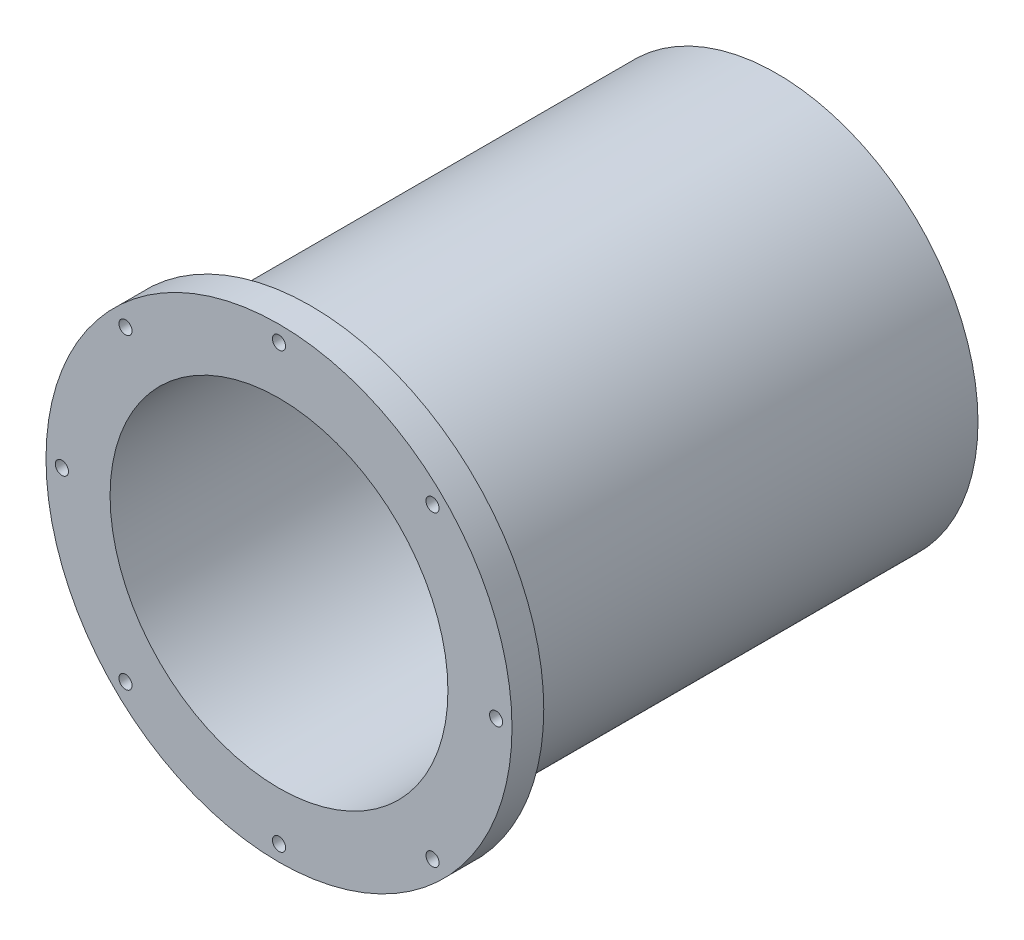
from build123d import *

# Parameters (mm, degrees)
IZIM1_R                     = 55
Y_KSEKLIK_EKSTR_ZYON1_DEPTH = 11
IZIM2_OUTSIDE_W             = 143.422
IZIM2_OUTSIDE_H             = 143.422
IZIM2_OUTSIDE_R             = 47.5
KES_EKSTR_ZYON1_DEPTH       = 14.5
IZIM3_R                     = 1.55
KES_EKSTR_ZYON2_DEPTH       = 80.121741639
DAIRESEL_KAPLAMA1_COUNT     = 8
IZIM4_R                     = 39.875
KES_EKSTR_ZYON3_DEPTH       = 81.833161512
IZIM5_R                     = 47.5
IZIM5_R_2                   = 39.875
Y_KSEKLIK_EKSTR_ZYON2_DEPTH = 95.5


with BuildPart() as part:
    # Çizim1 → Yükseklik-Ekstrüzyon1 (new, symmetric)
    with BuildSketch(Plane.XY):
        Circle(IZIM1_R)
    extrude(amount=Y_KSEKLIK_EKSTR_ZYON1_DEPTH, both=True)

    # Çizim2 outside → Kes-Ekstrüzyon1 (cut)
    with BuildSketch(Plane(origin=(0, 0, -11), x_dir=(-1, 0, 0), z_dir=(0, 0, -1))):
        Rectangle(IZIM2_OUTSIDE_W, IZIM2_OUTSIDE_H)
        Circle(IZIM2_OUTSIDE_R, mode=Mode.SUBTRACT)
    extrude(amount=-KES_EKSTR_ZYON1_DEPTH, mode=Mode.SUBTRACT)

    # Çizim3 → Kes-Ekstrüzyon2 (cut, through all)
    with BuildSketch(Plane(origin=(0, 0, 3.5), x_dir=(-1, 0, 0), z_dir=(0, 0, -1))):
        with Locations((0, 51.25)):
            Circle(IZIM3_R)
    kes_ekstr_zyon2 = extrude(amount=-KES_EKSTR_ZYON2_DEPTH, mode=Mode.SUBTRACT)

    # Dairesel Kaplama1: Kes-Ekstrüzyon2 ×8 about axis
    dairesel_kaplama1_axis = Axis((0, 0, 0), (0, 0, 1))
    for i in range(1, DAIRESEL_KAPLAMA1_COUNT):
        add(kes_ekstr_zyon2.rotate(dairesel_kaplama1_axis, i * 360 / DAIRESEL_KAPLAMA1_COUNT), mode=Mode.SUBTRACT)

    # Çizim4 → Kes-Ekstrüzyon3 (cut, through all)
    with BuildSketch(Plane.XY.offset(11)):
        Circle(IZIM4_R)
    extrude(amount=-KES_EKSTR_ZYON3_DEPTH, mode=Mode.SUBTRACT)

    # Çizim5 → Yükseklik-Ekstrüzyon2 (add)
    with BuildSketch(Plane(origin=(0, 0, -11), x_dir=(-1, 0, 0), z_dir=(0, 0, -1))):
        Circle(IZIM5_R)
        with Locations(Location((0, 0, 0), (0, 0, 180))):
            Circle(IZIM5_R_2, mode=Mode.SUBTRACT)
    extrude(amount=Y_KSEKLIK_EKSTR_ZYON2_DEPTH)


solid = part.part
